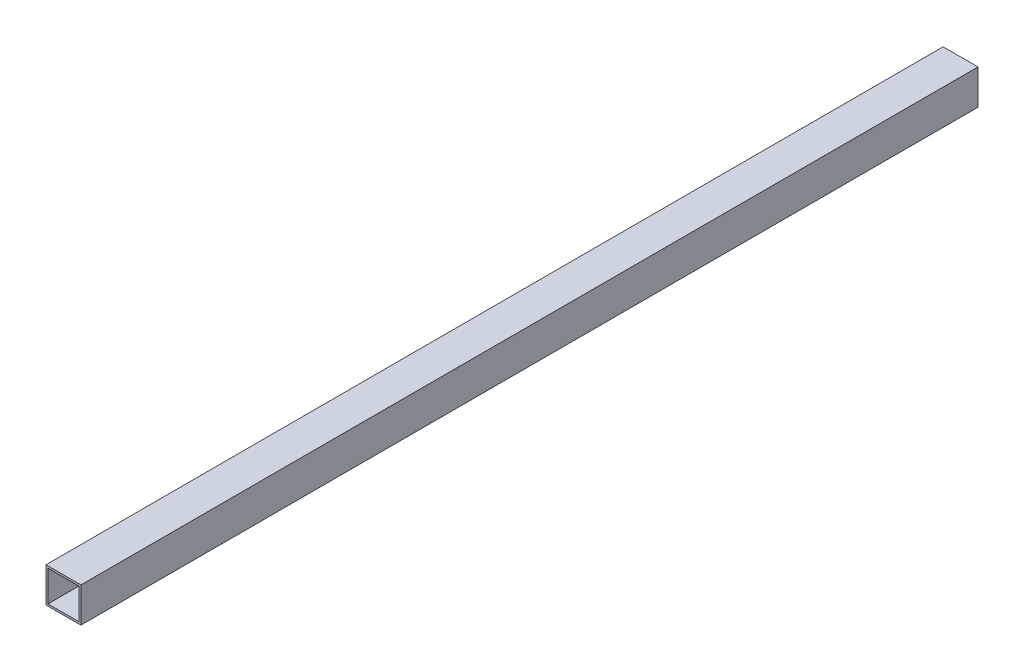
from build123d import *

# Parameters (mm, degrees)
SKETCH1_W           = 35
SKETCH1_H           = 35
SKETCH1_W_2         = 31
SKETCH1_H_2         = 31
BOSS_EXTRUDE1_DEPTH = 900


with BuildPart() as part:
    # Sketch1 → Boss-Extrude1 (new body)
    with BuildSketch(Plane.XY):
        Rectangle(SKETCH1_W, SKETCH1_H)
        Rectangle(SKETCH1_W_2, SKETCH1_H_2, mode=Mode.SUBTRACT)
    extrude(amount=BOSS_EXTRUDE1_DEPTH)


solid = part.part
